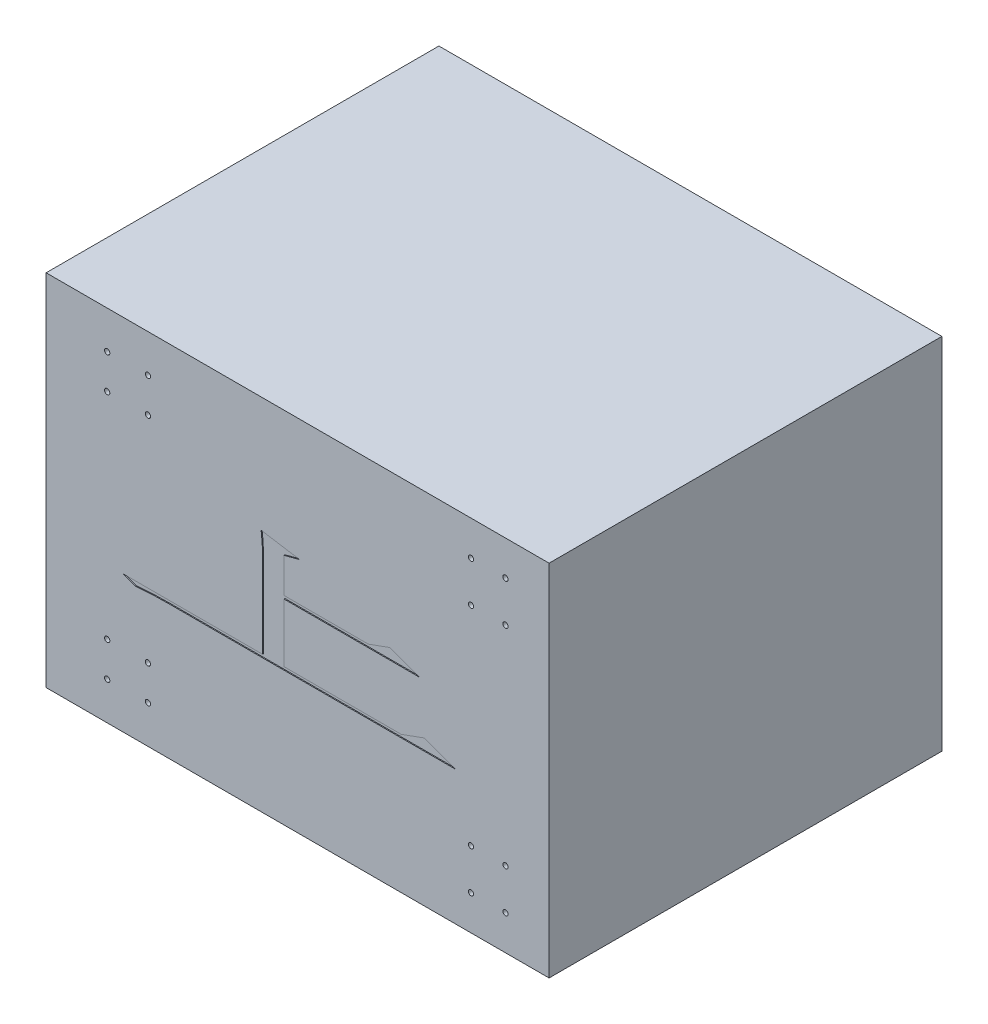
from build123d import *

# Parameters (mm, degrees)
SKETCH_1_W          = 1050
SKETCH_1_H          = 750
EXTRUDE_1_DEPTH     = 410
CUT_EXTRUDE_1_DEPTH = 2
SKETCH_3_W          = 44.350961538
SKETCH_3_H          = 70.432692308
SKETCH_3_W_2        = 43.26923077
SKETCH_3_H_2        = 67.868589743
CUT_EXTRUDE_2_DEPTH = 2
SKETCH_4_R          = 5.5
CUT_EXTRUDE_3_DEPTH = 1044.383918001


with BuildPart() as part:
    # 草图1 → 凸台-拉伸1 (new, symmetric)
    with BuildSketch(Plane.XY):
        Rectangle(SKETCH_1_W, SKETCH_1_H)
    extrude(amount=EXTRUDE_1_DEPTH, both=True)

    # 草图2 → 切除-拉伸1 (cut)
    with BuildSketch(Plane.XY.offset(410)):
        with BuildLine():
            Line((-76.251154182, 134.0391961), (4.317756074, 121.058426869))
            Line((4.317756074, 121.058426869), (-28.494743926, 112.404580715))
            Line((-28.494743926, 112.404580715), (-28.494743926, 39.928619177))
            Line((-28.494743926, 39.928619177), (147.586986844, 39.928619177))
            Line((147.586986844, 39.928619177), (192.37865351, 56.154580715))
            Line((192.37865351, 56.154580715), (255.038909921, 33.438234561))
            Line((255.038909921, 33.438234561), (-28.494743926, 33.438234561))
            Line((-28.494743926, 33.438234561), (-28.494743926, -88.797342362))
            Line((-28.494743926, -88.797342362), (216.256858639, -88.797342362))
            Line((216.256858639, -88.797342362), (264.013268895, -71.489650054))
            Line((264.013268895, -71.489650054), (329.678332998, -95.287726977))
            Line((329.678332998, -95.287726977), (-267.276795208, -95.287726977))
            add(Edge.make_bspline(
                [(-267.276795208, -95.287726977), (-273.620751945, -95.325303476), (-286.057863689, -95.398970927), (-304.346706585, -96.002609747), (-321.887243823, -97.027337306), (-333.317890865, -98.038240008), (-338.911410592, -98.532919285)],
                knots=[0, 0, 0, 0, 1.061212968, 2.080471985, 3.060690285, 4, 4, 4, 4], degree=3))
            Line((-338.911410592, -98.532919285), (-365.794423413, -88.797342362))
            Line((-365.794423413, -88.797342362), (-73.286410592, -88.797342362))
            Line((-73.286410592, -88.797342362), (-73.286410592, 92.933426869))
            add(Edge.make_bspline(
                [(-73.286410592, 92.933426869), (-73.334413425, 96.219120438), (-73.432034784, 102.901098434), (-73.934357846, 113.048263628), (-74.931633227, 123.464923567), (-75.806462429, 130.475560543), (-76.251154182, 134.0391961)],
                knots=[0, 0, 0, 0, 0.956090698, 1.944361784, 2.955081334, 4, 4, 4, 4], degree=3))
        make_face()
    extrude(amount=-CUT_EXTRUDE_1_DEPTH, mode=Mode.SUBTRACT)

    # 草图3 → 切除-拉伸2 (cut)
    # profile 1 of 9: a face of its own
    with BuildSketch(Plane.XZ.offset(375)):
        with BuildLine():
            add(Edge.make_bspline(
                [(-404.807692308, -86.738782051), (-404.799892776, -82.585443449), (-404.784644648, -74.465643327), (-404.893478511, -62.553437865), (-404.956781076, -51.175021558), (-405.074267337, -40.317449312), (-405.2527825, -29.994763235), (-405.379962594, -20.204495563), (-405.646456987, -10.950753367), (-405.810011732, -4.95460264), (-405.889423077, -2.043269231)],
                knots=[0, 0, 0, 0, 1.176774056, 2.30059984, 3.375236878, 4.400720187, 5.377068076, 6.300448943, 7.174810641, 8, 8, 8, 8], degree=3))
            Line((-405.889423077, -2.043269231), (-381.009615385, -14.0625))
            Line((-381.009615385, -14.0625), (-389.663461538, -20.592948718))
            Line((-389.663461538, -20.592948718), (-389.663461538, -84.575320513))
            Line((-389.663461538, -84.575320513), (-361.538461538, -79.166666667))
            add(Edge.make_bspline(
                [(-361.538461538, -79.166666667), (-361.530626213, -74.038439864), (-361.515343137, -64.03565347), (-361.623743276, -49.412405531), (-361.687656594, -35.523348588), (-361.803708403, -22.382137135), (-361.983807767, -9.962699167), (-362.109430245, 1.710405446), (-362.375166072, 12.647036331), (-362.540502834, 19.684828421), (-362.620192308, 23.076923077)],
                knots=[0, 0, 0, 0, 1.203660348, 2.34778176, 3.432348005, 4.463651956, 5.432303542, 6.347672805, 7.203606731, 8, 8, 8, 8], degree=3))
            Line((-362.620192308, 23.076923077), (-336.658653846, 9.975961538))
            Line((-336.658653846, 9.975961538), (-346.394230769, 3.405448718))
            Line((-346.394230769, 3.405448718), (-346.394230769, -29.407051282))
            Line((-346.394230769, -29.407051282), (-321.514423077, -29.407051282))
            Line((-321.514423077, -29.407051282), (-310.697115385, -18.58974359))
            Line((-310.697115385, -18.58974359), (-293.389423077, -35.897435897))
            Line((-293.389423077, -35.897435897), (-346.394230769, -35.897435897))
            Line((-346.394230769, -35.897435897), (-346.394230769, -75.921474359))
            Line((-346.394230769, -75.921474359), (-302.043269231, -66.185897436))
            Line((-302.043269231, -66.185897436), (-300.961538462, -70.512820513))
            add(Edge.make_bspline(
                [(-300.961538462, -70.512820513), (-303.913224017, -71.393238188), (-309.670724769, -73.110563876), (-318.09547259, -75.641532795), (-326.09602916, -78.041682138), (-333.68831737, -80.316402959), (-340.833021014, -82.537210656), (-347.572918266, -84.563949818), (-353.871396199, -86.503120997), (-359.771278173, -88.285674602), (-365.230857129, -90.032604873), (-370.298283331, -91.560327163), (-374.897878723, -93.082717017), (-379.111332731, -94.368746235), (-382.881242788, -95.627226399), (-386.227138186, -96.753911782), (-389.17953348, -97.699566896), (-392.460999823, -98.860464821), (-396.108079102, -100.17077468), (-400.108040107, -101.735718671), (-403.678137187, -103.296149598), (-406.879622699, -104.763047698), (-409.642236554, -106.247151167), (-412.013230252, -107.684806411), (-414.004997158, -109.06608487), (-415.112961549, -110.071987633), (-415.625, -110.536858974)],
                knots=[0, 0, 0, 0, 1.819420771, 3.548926964, 5.196075719, 6.753312958, 8.230490485, 9.61546289, 10.910532563, 12.123246011, 13.255940651, 14.296403935, 15.249368492, 16.117595642, 16.898389039, 17.596858801, 18.203035905, 18.729435959, 19.652750896, 20.49211647, 21.265864729, 21.954012815, 22.571630631, 23.116844881, 23.591855674, 24, 24, 24, 24], degree=3))
            Line((-415.625, -110.536858974), (-427.524038462, -89.983974359))
            add(Edge.make_bspline(
                [(-427.524038462, -89.983974359), (-423.643933233, -89.580429987), (-416.030259821, -88.788581604), (-408.500239139, -87.413224939), (-404.807692308, -86.738782051)],
                knots=[0, 0, 0, 0, 1.019246563, 2, 2, 2, 2], degree=3))
        make_face()
    # profile 2 of 9: a face of its own
    with BuildSketch(Plane.XZ.offset(375)):
        with BuildLine():
            add(Edge.make_bspline(
                [(-289.0625, -21.594551282), (-289.080879678, -18.068810816), (-289.118268257, -10.896627378), (-289.333549146, 0.067906138), (-289.635024506, 11.434492122), (-289.972524481, 19.15105108), (-290.144230769, 23.076923077)],
                knots=[0, 0, 0, 0, 0.946763555, 1.925939232, 2.944802063, 4, 4, 4, 4], degree=3))
            Line((-290.144230769, 23.076923077), (-263.100961538, 10.016025641))
            Line((-263.100961538, 10.016025641), (-273.918269231, 2.363782051))
            Line((-273.918269231, 2.363782051), (-273.918269231, -39.0625))
            add(Edge.make_bspline(
                [(-273.918269231, -39.0625), (-272.013162044, -38.063345575), (-267.981992376, -35.949154288), (-261.777217288, -32.260865348), (-255.0185978, -28.012280298), (-247.737643732, -23.21777054), (-240.205994484, -17.695950547), (-232.627175461, -11.37534592), (-225.03493263, -4.320830824), (-220.164590756, 0.813752719), (-217.668269231, 3.445512821)],
                knots=[0, 0, 0, 0, 0.728372157, 1.541221286, 2.443401956, 3.431780346, 4.492780516, 5.603946501, 6.771889103, 8, 8, 8, 8], degree=3))
            Line((-217.668269231, 3.445512821), (-200.360576923, -16.145833333))
            Line((-200.360576923, -16.145833333), (-213.341346154, -17.267628205))
            add(Edge.make_bspline(
                [(-213.341346154, -17.267628205), (-216.410350063, -18.848511822), (-222.388915106, -21.928148019), (-231.14471659, -26.33290881), (-239.42973809, -30.370066627), (-247.234379963, -34.087803439), (-254.580681975, -37.422759778), (-261.429410925, -40.491045376), (-267.815447513, -43.187176684), (-271.938717472, -44.812596533), (-273.918269231, -45.592948718)],
                knots=[0, 0, 0, 0, 1.238433146, 2.412526454, 3.515967226, 4.544591564, 5.513609216, 6.410099942, 7.236700607, 8, 8, 8, 8], degree=3))
            Line((-273.918269231, -45.592948718), (-273.918269231, -73.958333333))
            add(Edge.make_bspline(
                [(-273.918269231, -73.958333333), (-273.895201564, -74.976265029), (-273.851447296, -76.907056568), (-273.326251299, -79.59239488), (-272.520423572, -81.908334717), (-271.265039657, -83.749186577), (-269.753575448, -85.276994365), (-267.817568963, -86.315028208), (-265.554266487, -86.919785124), (-263.946326914, -86.984963564), (-263.100961538, -87.019230769)],
                knots=[0, 0, 0, 0, 1.258486359, 2.387070591, 3.376064703, 4.270393409, 5.124049302, 6.012241891, 6.95494712, 8, 8, 8, 8], degree=3))
            Line((-263.100961538, -87.019230769), (-221.995192308, -87.019230769))
            add(Edge.make_bspline(
                [(-221.995192308, -87.019230769), (-221.137604323, -86.982793758), (-219.492621999, -86.912902109), (-217.152824389, -86.325829008), (-215.151814041, -85.227847521), (-213.363697451, -83.82469459), (-211.978956102, -81.916699801), (-210.819943338, -79.670371157), (-210.061967332, -76.983771686), (-209.345860784, -72.874787336), (-208.831686479, -67.328031734), (-208.277365862, -60.438316938), (-208.021842004, -53.260333725), (-207.962834843, -48.397523353), (-207.932692308, -45.913461538)],
                knots=[0, 0, 0, 0, 0.640115454, 1.227837405, 1.780959176, 2.333811241, 2.910173113, 3.525580197, 4.213246791, 4.983825321, 6.63887077, 8.368789989, 10.145074671, 12, 12, 12, 12], degree=3))
            Line((-207.932692308, -45.913461538), (-203.605769231, -45.913461538))
            add(Edge.make_bspline(
                [(-203.605769231, -45.913461538), (-203.428531124, -48.318030256), (-203.092462158, -52.877438706), (-202.465805343, -59.345345367), (-201.712486274, -65.056056581), (-201.152928561, -69.393781069), (-200.418943037, -72.524082236), (-199.560380496, -74.663383009), (-198.443323087, -76.680989806), (-196.987079728, -78.557554123), (-195.289441245, -80.338596859), (-193.288790119, -82.006766032), (-190.99875101, -83.526090173), (-189.324789516, -84.403364544), (-188.461538462, -84.855769231)],
                knots=[0, 0, 0, 0, 1.952993343, 3.703156532, 5.26223588, 6.619235047, 7.243646851, 7.860327455, 8.48022538, 9.105479909, 9.7787641, 10.469886722, 11.210930534, 12, 12, 12, 12], degree=3))
            add(Edge.make_bspline(
                [(-188.461538462, -84.855769231), (-189.352186864, -86.368267844), (-191.027576677, -89.213413879), (-194.085124487, -92.814127198), (-197.33241993, -95.569218048), (-200.836913161, -97.406363851), (-204.434430413, -98.517240431), (-208.048004022, -99.371831049), (-211.748879078, -99.919207338), (-214.247615162, -99.972956906), (-215.504807692, -100)],
                knots=[0, 0, 0, 0, 1.27993623, 2.407675258, 3.43295007, 4.371008769, 5.274719207, 6.176110814, 7.08234412, 8, 8, 8, 8], degree=3))
            Line((-215.504807692, -100), (-269.591346154, -100))
            add(Edge.make_bspline(
                [(-269.591346154, -100), (-271.119047838, -99.957345009), (-274.003245979, -99.876815252), (-278.017626281, -98.99096874), (-281.46211219, -97.563797232), (-284.242961692, -95.451077684), (-286.511672758, -92.823715945), (-288.01700843, -89.519889227), (-288.885876803, -85.675076793), (-289.001415311, -82.937649892), (-289.0625, -81.490384615)],
                knots=[0, 0, 0, 0, 1.189363692, 2.245438743, 3.18754953, 4.072688701, 4.944682885, 5.866959989, 6.872271351, 8, 8, 8, 8], degree=3))
            Line((-289.0625, -81.490384615), (-289.0625, -21.594551282))
        make_face()
    # profile 3 of 9: a face of its own
    with BuildSketch(Plane.XZ.offset(375)):
        with BuildLine():
            add(Edge.make_bspline(
                [(-303.125, -138.461538462), (-303.123875317, -141.26602269), (-303.121690219, -146.714734905), (-303.137077022, -154.660857997), (-303.083385747, -162.166132418), (-303.046643286, -169.230775697), (-303.007113735, -175.854721228), (-302.962555851, -182.024541561), (-302.938632894, -187.754039848), (-302.845496639, -193.042230298), (-302.768979719, -197.876672874), (-302.688990819, -202.270404519), (-302.605564182, -206.209928421), (-302.541131463, -209.723151019), (-302.412263668, -212.780839505), (-302.294053299, -215.39846124), (-302.179035046, -217.562418797), (-302.084982997, -218.856944463), (-302.043269231, -219.431089744)],
                knots=[0, 0, 0, 0, 1.662194663, 3.229406773, 4.709572707, 6.110587711, 7.416621788, 8.635590239, 9.767493327, 10.812421321, 11.770292876, 12.633196279, 13.416962222, 14.10576766, 14.715701438, 15.230737947, 15.658818524, 16, 16, 16, 16], degree=3))
            Line((-302.043269231, -219.431089744), (-319.350961538, -228.205128205))
            add(Edge.make_bspline(
                [(-319.350961538, -228.205128205), (-319.177502556, -221.634890995), (-318.821098172, -208.135092286), (-318.529750279, -187.340419387), (-318.319535912, -165.451820371), (-318.286276116, -150.494181539), (-318.269230769, -142.828525641)],
                knots=[0, 0, 0, 0, 0.92368316, 1.897882272, 2.922683497, 4, 4, 4, 4], degree=3))
            add(Edge.make_bspline(
                [(-318.269230769, -142.828525641), (-320.229530413, -145.086665484), (-324.128442846, -149.577963301), (-330.246451655, -156.036186214), (-336.53689151, -162.253038569), (-343.032042698, -168.225795219), (-349.726630804, -173.958902293), (-356.622370273, -179.450719107), (-363.702551033, -184.692156753), (-370.980463707, -189.685214891), (-378.46574338, -194.391522729), (-386.129518067, -198.890691221), (-393.97588767, -203.149302373), (-402.05658488, -207.097345148), (-410.283446157, -210.876201224), (-418.73401616, -214.364849624), (-427.366689003, -217.610289283), (-433.233452254, -219.569559162), (-436.177884615, -220.552884615)],
                knots=[0, 0, 0, 0, 1.002971515, 1.994847125, 2.983165634, 3.969156496, 4.954057883, 5.939112072, 6.925560766, 7.908412301, 8.898951696, 9.890827306, 10.889025509, 11.892737054, 12.907088703, 13.92535985, 14.958772097, 16, 16, 16, 16], degree=3))
            Line((-436.177884615, -220.552884615), (-437.259615385, -216.185897436))
            add(Edge.make_bspline(
                [(-437.259615385, -216.185897436), (-431.889093174, -213.597507198), (-421.336404608, -208.511507181), (-406.249257866, -200.049320339), (-392.060440041, -191.144719118), (-378.890014566, -181.625187562), (-366.590952715, -171.682175698), (-355.288439465, -161.168581101), (-344.883708659, -150.159872184), (-338.662153898, -142.33957556), (-335.576923077, -138.461538462)],
                knots=[0, 0, 0, 0, 1.106797206, 2.174776634, 3.210193074, 4.215695543, 5.190514629, 6.145059252, 7.080146268, 8, 8, 8, 8], degree=3))
            Line((-335.576923077, -138.461538462), (-414.543269231, -138.461538462))
            Line((-414.543269231, -138.461538462), (-424.278846154, -140.625))
            Line((-424.278846154, -140.625), (-432.932692308, -131.971153846))
            Line((-432.932692308, -131.971153846), (-318.269230769, -131.971153846))
            add(Edge.make_bspline(
                [(-318.269230769, -131.971153846), (-318.288090432, -129.353508666), (-318.327065359, -123.94394568), (-318.543486171, -115.556843014), (-318.846805886, -106.633908506), (-319.179730648, -100.506986609), (-319.350961538, -97.355769231)],
                knots=[0, 0, 0, 0, 0.90691056, 1.874199695, 2.906651827, 4, 4, 4, 4], degree=3))
            Line((-319.350961538, -97.355769231), (-292.307692308, -110.336538462))
            Line((-292.307692308, -110.336538462), (-303.125, -116.826923077))
            Line((-303.125, -116.826923077), (-303.125, -131.971153846))
            Line((-303.125, -131.971153846), (-221.995192308, -131.971153846))
            Line((-221.995192308, -131.971153846), (-205.769230769, -115.745192308))
            Line((-205.769230769, -115.745192308), (-183.052884615, -138.461538462))
            Line((-183.052884615, -138.461538462), (-294.471153846, -138.461538462))
            add(Edge.make_bspline(
                [(-294.471153846, -138.461538462), (-292.704896767, -140.486333099), (-289.193796037, -144.511374534), (-283.53680006, -150.141630883), (-277.743759715, -155.524475662), (-271.72523596, -160.577102305), (-265.490953639, -165.317336316), (-259.062173019, -169.766979249), (-252.391806735, -173.854905171), (-245.523251162, -177.61856537), (-238.464648712, -181.121422145), (-231.181479496, -184.289609522), (-223.663346231, -187.07499936), (-215.961414939, -189.620199117), (-208.030627503, -191.817158535), (-199.884085257, -193.680224288), (-191.555157095, -195.325297509), (-185.902122426, -196.089291408), (-183.052884615, -196.474358974)],
                knots=[0, 0, 0, 0, 1.00227071, 1.992390272, 2.976220261, 3.952385687, 4.923105148, 5.897564813, 6.868424952, 7.840780129, 8.819092609, 9.807756554, 10.802729427, 11.809659271, 12.833656939, 13.871970379, 14.927432289, 16, 16, 16, 16], degree=3))
            Line((-183.052884615, -196.474358974), (-183.052884615, -200.841346154))
            add(Edge.make_bspline(
                [(-183.052884615, -200.841346154), (-184.35339265, -201.056460252), (-186.847167761, -201.468949963), (-190.375918559, -202.469663005), (-193.517644788, -203.800121492), (-196.322335847, -205.387780759), (-198.724464103, -207.345151985), (-200.750318148, -209.616980507), (-202.418594063, -212.200391527), (-203.206848615, -214.101823871), (-203.605769231, -215.064102564)],
                knots=[0, 0, 0, 0, 1.198293132, 2.29777403, 3.326477309, 4.295206544, 5.219035116, 6.130888892, 7.054078469, 8, 8, 8, 8], degree=3))
            add(Edge.make_bspline(
                [(-203.605769231, -215.064102564), (-206.15205199, -214.138931571), (-211.207176322, -212.302193533), (-218.593046202, -209.155603408), (-225.750926661, -205.73649), (-232.748599604, -202.142894035), (-239.519239497, -198.262081486), (-246.051810818, -194.077421571), (-252.388138139, -189.668924746), (-258.534705403, -185.01850654), (-264.454977253, -180.096666549), (-270.151349795, -174.911541717), (-275.654885152, -169.495321735), (-280.951311242, -163.814162524), (-285.974444481, -157.829969785), (-290.850370385, -151.649038336), (-295.510137523, -145.197483661), (-298.416172339, -140.717765397), (-299.879807692, -138.461538462)],
                knots=[0, 0, 0, 0, 1.036595478, 2.057948595, 3.070647218, 4.071803187, 5.067649195, 6.055793975, 7.03968734, 8.020935843, 9.004417662, 9.98486732, 10.967831143, 11.958655097, 12.955903272, 13.956811373, 14.970940371, 16, 16, 16, 16], degree=3))
            Line((-299.879807692, -138.461538462), (-303.125, -138.461538462))
        make_face()
    # profile 4 of 9: a face of its own
    with BuildSketch(Plane.XZ.offset(375)):
        with BuildLine():
            add(Edge.make_bspline(
                [(-62.980769231, -220.512820513), (-62.809549569, -217.014332391), (-62.4763449, -210.206045536), (-62.17161305, -200.255019167), (-61.95650096, -190.839595047), (-61.917824698, -184.735687078), (-61.899038462, -181.770833333)],
                knots=[0, 0, 0, 0, 1.084377967, 2.110270495, 3.082100905, 4, 4, 4, 4], degree=3))
            Line((-61.899038462, -181.770833333), (-61.899038462, -68.709935897))
            add(Edge.make_bspline(
                [(-61.899038462, -68.709935897), (-61.951936505, -62.525553755), (-62.059487887, -49.951575395), (-62.670352238, -37.391928779), (-62.980769231, -31.009615385)],
                knots=[0, 0, 0, 0, 0.983679463, 2, 2, 2, 2], degree=3))
            Line((-62.980769231, -31.009615385), (-47.836538462, -39.663461538))
            Line((-47.836538462, -39.663461538), (-4.567307692, -39.663461538))
            add(Edge.make_bspline(
                [(-4.567307692, -39.663461538), (-4.568425052, -37.406520717), (-4.570606879, -32.999476511), (-4.555157505, -26.57577108), (-4.608727542, -20.512819366), (-4.645759259, -14.823710443), (-4.68540971, -9.48181432), (-4.729441844, -4.500569514), (-4.754106098, 0.133912342), (-4.846162674, 4.393745599), (-4.923716163, 8.293348848), (-5.003372697, 11.832393023), (-5.086467366, 15.010684439), (-5.151481799, 17.84301658), (-5.279126433, 20.299688449), (-5.400125955, 22.409669879), (-5.510960893, 24.146710566), (-5.607096394, 25.187116552), (-5.649038462, 25.641025641)],
                knots=[0, 0, 0, 0, 1.658358736, 3.238215284, 4.719976587, 6.113424988, 7.418560765, 8.645196714, 9.77370834, 10.823858514, 11.775899855, 12.63964692, 13.424914088, 14.112088547, 14.72119231, 15.232305013, 15.665069467, 16, 16, 16, 16], degree=3))
            Line((-5.649038462, 25.641025641), (19.230769231, 14.943910256))
            Line((19.230769231, 14.943910256), (9.495192308, 7.451923077))
            Line((9.495192308, 7.451923077), (9.495192308, -39.663461538))
            Line((9.495192308, -39.663461538), (52.764423077, -39.663461538))
            Line((52.764423077, -39.663461538), (60.336538462, -28.846153846))
            Line((60.336538462, -28.846153846), (76.5625, -42.908653846))
            Line((76.5625, -42.908653846), (67.908653846, -49.358974359))
            Line((67.908653846, -49.358974359), (67.908653846, -182.852564103))
            add(Edge.make_bspline(
                [(67.908653846, -182.852564103), (67.958843528, -187.875485571), (68.059285135, -197.927557792), (68.679889925, -207.960959513), (68.990384615, -212.980769231)],
                knots=[0, 0, 0, 0, 0.999380299, 2, 2, 2, 2], degree=3))
            Line((68.990384615, -212.980769231), (53.846153846, -220.512820513))
            Line((53.846153846, -220.512820513), (53.846153846, -197.435897436))
            Line((53.846153846, -197.435897436), (-47.836538462, -197.435897436))
            Line((-47.836538462, -197.435897436), (-47.836538462, -213.90224359))
            Line((-47.836538462, -213.90224359), (-62.980769231, -220.512820513))
        make_face()
        with Locations((31.670673077, -155.729166667)):
            Rectangle(SKETCH_3_W, SKETCH_3_H, mode=Mode.SUBTRACT)
        with Locations((-26.201923077, -80.088141026)):
            Rectangle(SKETCH_3_W_2, SKETCH_3_H_2, mode=Mode.SUBTRACT)
        with Locations((31.670673077, -80.088141026)):
            Rectangle(SKETCH_3_W, SKETCH_3_H_2, mode=Mode.SUBTRACT)
        with Locations((-26.201923077, -155.729166667)):
            Rectangle(SKETCH_3_W_2, SKETCH_3_H, mode=Mode.SUBTRACT)
    # profile 5 of 9: a face of its own
    with BuildSketch(Plane.XZ.offset(375)):
        with BuildLine():
            add(Edge.make_bspline(
                [(-68.389423077, -29.52724359), (-69.927313847, -34.133917263), (-72.917510885, -43.090900584), (-77.235744749, -56.141341095), (-81.286357233, -68.399599681), (-85.049147177, -79.876753482), (-88.57537333, -90.555916915), (-91.832838169, -100.461131989), (-94.776185529, -109.593718599), (-97.52116709, -117.929345415), (-99.956534394, -125.490941785), (-102.11942461, -132.261951698), (-104.018186842, -138.240042715), (-105.599784321, -143.445690614), (-106.98212117, -147.855793464), (-108.063720326, -151.488807188), (-108.864541351, -154.350628547), (-109.955851049, -158.304351362), (-110.989848727, -163.96286493), (-112.057390448, -171.767227931), (-112.621867458, -180.333341144), (-112.755563047, -187.819800241), (-112.737819343, -193.856836792), (-112.740954201, -198.063567363), (-112.740335554, -201.842952759), (-112.740158899, -205.208320726), (-112.741168003, -208.146406573), (-112.738075855, -210.683646442), (-112.746917375, -212.794126503), (-112.717304924, -214.921156609), (-112.86684746, -217.01911595), (-113.633622399, -219.047123799), (-115.165839936, -220.359184961), (-116.416212374, -220.460213053), (-117.067307692, -220.512820513)],
                knots=[0, 0, 0, 0, 2.330176268, 4.530676893, 6.595424638, 8.524422367, 10.325760191, 11.991349383, 13.527287595, 14.929469261, 16.202006203, 17.338815461, 18.339909382, 19.211428259, 19.949157814, 20.557367496, 21.030007305, 21.375063583, 22.524872345, 23.785398983, 25.153583848, 26.640476982, 27.377343417, 28.050134511, 28.658850262, 29.190675603, 29.664833135, 30.068507791, 30.408107105, 30.677223542, 31.089751325, 31.411151606, 31.693374213, 32, 32, 32, 32], degree=3))
            add(Edge.make_bspline(
                [(-117.067307692, -220.512820513), (-117.683859699, -220.475508926), (-119.107131193, -220.389377477), (-121.446013379, -219.810136065), (-124.258947988, -218.94418399), (-127.402896473, -217.906831259), (-130.512116014, -216.338910392), (-132.798129675, -213.709891972), (-134.182126133, -210.366535381), (-134.307753797, -207.894010448), (-134.375, -206.570512821)],
                knots=[0, 0, 0, 0, 0.595270163, 1.374143697, 2.31631919, 3.437627346, 4.574611688, 5.6248949, 6.728649437, 8, 8, 8, 8], degree=3))
            add(Edge.make_bspline(
                [(-134.375, -206.570512821), (-134.272341535, -204.047730741), (-134.06554906, -198.965905752), (-132.832474818, -194.031354813), (-132.211538462, -191.546474359)],
                knots=[0, 0, 0, 0, 0.992864605, 2, 2, 2, 2], degree=3))
            add(Edge.make_bspline(
                [(-132.211538462, -191.546474359), (-131.729783343, -189.854208883), (-130.820423429, -186.659892254), (-129.753885988, -182.09687749), (-129.111365736, -178.04981414), (-129.012068858, -175.522646013), (-128.966346154, -174.358974359)],
                knots=[0, 0, 0, 0, 1.203293849, 2.271334849, 3.204010761, 4, 4, 4, 4], degree=3))
            add(Edge.make_bspline(
                [(-128.966346154, -174.358974359), (-129.032114816, -173.325309463), (-129.160220979, -171.311906113), (-130.048421215, -168.400032849), (-131.695396556, -165.85431255), (-133.469451682, -163.903928758), (-135.312921158, -162.506930629), (-137.062531071, -161.409095176), (-139.182573486, -160.358799259), (-141.640343207, -159.272019239), (-144.442861448, -158.186161268), (-147.628349244, -157.173004102), (-151.145518453, -156.073989327), (-153.629976865, -155.400115727), (-154.927884615, -155.048076923)],
                knots=[0, 0, 0, 0, 1.061906119, 2.068412448, 3.084778515, 4.152427813, 4.758781837, 5.455256692, 6.271167899, 7.186216139, 8.215368344, 9.356203438, 10.618852289, 12, 12, 12, 12], degree=3))
            Line((-154.927884615, -155.048076923), (-154.927884615, -150.761217949))
            add(Edge.make_bspline(
                [(-154.927884615, -150.761217949), (-153.538680132, -150.91858076), (-150.893612878, -151.218202037), (-147.107344644, -151.692757185), (-143.6716228, -151.997487761), (-140.58688363, -152.245178699), (-137.86214393, -152.407206384), (-135.483904406, -152.496877331), (-133.466767348, -152.492083704), (-131.210946578, -152.440200135), (-128.506128257, -151.695368284), (-125.455007544, -149.692224572), (-122.518641659, -146.610215506), (-120.309480622, -143.692223061), (-118.773191888, -141.009086172), (-117.609300711, -138.737727256), (-116.18735603, -135.714687953), (-114.515957727, -131.91800695), (-112.503120851, -127.41994308), (-110.268805867, -122.148091428), (-107.742712326, -116.139330737), (-104.93940477, -109.367878073), (-101.86803356, -101.8436335), (-98.480615672, -93.591327771), (-94.902099625, -84.55516513), (-90.949063794, -74.800887304), (-86.809653959, -64.261179359), (-82.347595326, -52.995737178), (-77.623034241, -40.975295915), (-74.384769184, -32.706019768), (-72.716346154, -28.445512821)],
                knots=[0, 0, 0, 0, 0.721490397, 1.373729098, 1.968972639, 2.501240816, 2.97068533, 3.377528162, 3.729003983, 4.011898956, 4.540181391, 5.15016345, 5.87139048, 6.728733543, 7.03134042, 7.46595378, 8.045511111, 8.755053279, 9.606643322, 10.588484413, 11.709712696, 12.970363299, 14.370460851, 15.903639561, 17.573717696, 19.385850263, 21.334929756, 23.417107745, 25.638796438, 28, 28, 28, 28], degree=3))
            Line((-72.716346154, -28.445512821), (-68.389423077, -29.52724359))
        make_face()
    # profile 6 of 9: a face of its own
    with BuildSketch(Plane.XZ.offset(375)):
        with BuildLine():
            add(Edge.make_bspline(
                [(-153.846153846, -48.317307692), (-151.043389801, -49.57473843), (-145.749940501, -51.949589024), (-138.464380837, -55.668235506), (-132.248578743, -59.21627175), (-127.138253755, -62.630926374), (-123.107697133, -65.909799495), (-120.148042997, -69.015884204), (-118.194678303, -72.040354115), (-117.386312344, -75.81790412), (-117.563793838, -79.88053575), (-117.983099259, -84.064159933), (-118.97216172, -87.443657006), (-120.713725597, -89.780877469), (-122.500242275, -91.373438656), (-124.096695411, -92.490234658), (-125.481190692, -93.281002755), (-126.395268767, -93.41140214), (-126.802884615, -93.469551282)],
                knots=[0, 0, 0, 0, 2.137318138, 4.036652752, 5.689570708, 7.114910685, 8.309515839, 9.295970364, 10.096028149, 10.774477224, 11.945389058, 12.910156725, 13.703602796, 14.356097679, 14.908696276, 15.362435972, 15.715690367, 16, 16, 16, 16], degree=3))
            add(Edge.make_bspline(
                [(-126.802884615, -93.469551282), (-127.364164293, -93.313568552), (-128.715616883, -92.937992395), (-130.315741098, -90.853488884), (-131.863321555, -87.85644623), (-132.77494382, -85.407074196), (-133.293269231, -84.014423077)],
                knots=[0, 0, 0, 0, 0.573729661, 1.381429734, 2.511147037, 4, 4, 4, 4], degree=3))
            add(Edge.make_bspline(
                [(-133.293269231, -84.014423077), (-133.698466686, -82.909695697), (-134.556571714, -80.570164424), (-136.390486799, -77.064955679), (-138.539195725, -73.230072032), (-141.203286954, -69.178437504), (-144.261553412, -64.835365073), (-147.741949518, -60.221731691), (-151.729140241, -55.395691685), (-154.548660647, -52.105485156), (-156.009615385, -50.400641026)],
                knots=[0, 0, 0, 0, 0.691799597, 1.465055381, 2.323882694, 3.278718458, 4.31662617, 5.449951299, 6.678673961, 8, 8, 8, 8], degree=3))
            Line((-156.009615385, -50.400641026), (-153.846153846, -48.317307692))
        make_face()
    # profile 7 of 9: a face of its own
    with BuildSketch(Plane.XZ.offset(375)):
        with BuildLine():
            add(Edge.make_bspline(
                [(-128.966346154, 10.496794872), (-126.663985549, 9.480108685), (-122.306771813, 7.556031713), (-116.227807096, 4.659148902), (-110.924665332, 2.050626099), (-106.474415474, -0.40520853), (-102.79617894, -2.582943309), (-99.935823274, -4.578984807), (-97.826567676, -6.326106005), (-96.230458872, -8.403110519), (-95.1871361, -10.758597864), (-94.065363435, -13.147809807), (-93.426431317, -15.271949658), (-93.31769183, -16.596982965), (-93.269230769, -17.1875)],
                knots=[0, 0, 0, 0, 1.910941389, 3.6164535, 5.11297384, 6.397322516, 7.475544486, 8.356123146, 9.045817229, 9.544760398, 10.329312956, 10.992403041, 11.550952293, 12, 12, 12, 12], degree=3))
            add(Edge.make_bspline(
                [(-93.269230769, -17.1875), (-93.313244068, -17.938354045), (-93.406433028, -19.52813054), (-94.040537575, -21.988973807), (-95.13754101, -24.602936265), (-96.447336953, -27.291919446), (-97.901688461, -29.7276859), (-99.31539646, -31.548802585), (-100.552362428, -32.867512941), (-101.519966011, -33.083214172), (-101.923076923, -33.173076923)],
                knots=[0, 0, 0, 0, 0.950821945, 2.013166728, 3.197105655, 4.535802205, 5.803276501, 6.767391034, 7.486485857, 8, 8, 8, 8], degree=3))
            add(Edge.make_bspline(
                [(-101.923076923, -33.173076923), (-102.482032344, -33.044720186), (-103.8022186, -32.741556831), (-105.41934131, -30.847997041), (-106.975015723, -28.124345474), (-107.893745864, -25.89853814), (-108.413461538, -24.639423077)],
                knots=[0, 0, 0, 0, 0.602985712, 1.424180568, 2.542886889, 4, 4, 4, 4], degree=3))
            add(Edge.make_bspline(
                [(-108.413461538, -24.639423077), (-108.987153235, -23.456916053), (-110.171985223, -21.01471207), (-112.288511833, -17.366980963), (-114.68583477, -13.575071402), (-117.378535124, -9.651131595), (-120.353247955, -5.575102275), (-123.680139528, -1.400620918), (-127.281053915, 2.932551454), (-129.82677561, 5.815846881), (-131.129807692, 7.291666667)],
                knots=[0, 0, 0, 0, 0.802080547, 1.656518116, 2.572519223, 3.54031123, 4.561043358, 5.652173592, 6.798260965, 8, 8, 8, 8], degree=3))
            Line((-131.129807692, 7.291666667), (-128.966346154, 10.496794872))
        make_face()
    # profile 8 of 9: a face of its own
    with BuildSketch(Plane.XZ.offset(375)):
        with BuildLine():
            Line((252.884615385, -7.692307692), (252.884615385, -101.72275641))
            add(Edge.make_bspline(
                [(252.884615385, -101.72275641), (252.841196881, -105.00951256), (252.755664416, -111.484271731), (251.995364298, -121.05604814), (250.866218244, -130.328536992), (249.221965485, -139.322846511), (247.051511147, -147.998270477), (244.448307507, -156.386851837), (241.403176734, -164.496027392), (237.826387667, -172.283747153), (233.833845865, -179.819775895), (229.271512789, -186.989530467), (224.295606816, -193.89237629), (218.888770346, -200.537755161), (212.929036615, -206.827927403), (206.504284524, -212.827125999), (199.664109052, -218.60029022), (194.776093449, -222.107232705), (192.307692308, -223.878205128)],
                knots=[0, 0, 0, 0, 1.108626279, 2.183943025, 3.237300058, 4.258815003, 5.266274601, 6.252363065, 7.220493292, 8.186198952, 9.141582016, 10.095274576, 11.05056203, 12.011041014, 12.983104791, 13.971187867, 14.975469272, 16, 16, 16, 16], degree=3))
            Line((192.307692308, -223.878205128), (189.0625, -220.633012821))
            add(Edge.make_bspline(
                [(189.0625, -220.633012821), (191.046217027, -218.770916302), (194.993539843, -215.065601495), (200.518880588, -209.165930014), (205.656301166, -203.017319127), (210.433419383, -196.648923934), (214.815694501, -190.030298105), (218.754751276, -183.149760457), (222.458169872, -176.107289916), (225.621056901, -168.755833253), (228.492171238, -161.196888855), (230.969639429, -153.399983415), (233.045770399, -145.357823197), (234.782724557, -137.099386732), (236.085192756, -128.590371868), (237.056494442, -119.850249829), (237.6169325, -110.864744435), (237.698896234, -104.795091626), (237.740384615, -101.72275641)],
                knots=[0, 0, 0, 0, 0.985314845, 1.960640411, 2.925594497, 3.886283397, 4.842871568, 5.798676654, 6.757109883, 7.723227236, 8.695332628, 9.685137536, 10.684763635, 11.702725791, 12.740583817, 13.80148723, 14.887157401, 16, 16, 16, 16], degree=3))
            Line((237.740384615, -101.72275641), (237.740384615, -49.83974359))
            add(Edge.make_bspline(
                [(237.740384615, -49.83974359), (237.688631962, -40.023282656), (237.584124484, -20.200268733), (236.969109945, -0.386500964), (236.658653846, 9.615384615)],
                knots=[0, 0, 0, 0, 0.990410537, 2, 2, 2, 2], degree=3))
            Line((236.658653846, 9.615384615), (252.884615385, -1.201923077))
            Line((252.884615385, -1.201923077), (302.644230769, -1.201923077))
            Line((302.644230769, -1.201923077), (312.379807692, 9.615384615))
            Line((312.379807692, 9.615384615), (329.6875, -5.528846154))
            Line((329.6875, -5.528846154), (318.870192308, -12.059294872))
            Line((318.870192308, -12.059294872), (318.870192308, -188.982371795))
            add(Edge.make_bspline(
                [(318.870192308, -188.982371795), (318.892286555, -189.840572044), (318.933853232, -191.455134011), (319.464870538, -193.693712539), (320.301456403, -195.61482948), (321.541997416, -197.151144387), (323.068005336, -198.431373787), (325.008738042, -199.233255849), (327.240407853, -199.775724613), (328.842296121, -199.817632004), (329.6875, -199.83974359)],
                knots=[0, 0, 0, 0, 1.17022464, 2.201584301, 3.124385285, 4.007915669, 4.87719616, 5.81662875, 6.847988411, 8, 8, 8, 8], degree=3))
            Line((329.6875, -199.83974359), (342.668269231, -199.83974359))
            add(Edge.make_bspline(
                [(342.668269231, -199.83974359), (343.523051072, -199.725124497), (345.270798361, -199.490766208), (347.550747246, -197.646877827), (349.173922669, -194.760175245), (350.180979854, -191.664817911), (350.83113769, -188.475994076), (351.274591729, -185.287466502), (351.783085071, -181.43291913), (352.139682888, -176.897430032), (352.559961969, -171.691571833), (352.905740265, -165.813772286), (353.230543321, -159.256501221), (353.397663493, -154.661032369), (353.485576923, -152.243589744)],
                knots=[0, 0, 0, 0, 0.593285662, 1.213073742, 1.959102594, 2.885957232, 3.477257056, 4.23234027, 5.135388809, 6.194265944, 7.411285708, 8.785969923, 10.309262111, 12, 12, 12, 12], degree=3))
            Line((353.485576923, -152.243589744), (358.894230769, -152.243589744))
            add(Edge.make_bspline(
                [(358.894230769, -152.243589744), (358.906765161, -154.139914537), (358.930864031, -157.785826212), (358.978419809, -163.009610806), (359.19855371, -167.73665722), (359.43729081, -171.97036493), (359.697303629, -175.713677558), (360.053220405, -178.975380542), (360.482011662, -181.746564221), (361.143503854, -184.750355592), (362.375393484, -188.059900201), (364.802214423, -191.432899212), (367.94213104, -194.420289676), (370.526930793, -195.84927979), (371.875, -196.594551282)],
                knots=[0, 0, 0, 0, 1.392277126, 2.676819629, 3.834791772, 4.865946343, 5.79012363, 6.58917741, 7.274232445, 7.847440921, 8.84702178, 9.839799572, 10.873375133, 12, 12, 12, 12], degree=3))
            add(Edge.make_bspline(
                [(371.875, -196.594551282), (371.341432093, -197.630684786), (370.327423307, -199.599784621), (368.656931626, -202.300772284), (367.035109205, -204.683184206), (365.354745373, -206.708319986), (363.615856277, -208.351836949), (361.914589454, -209.705998391), (360.146055466, -210.659869259), (356.70488678, -211.761465489), (351.57023775, -212.527070546), (347.036578232, -212.724498161), (344.831730769, -212.820512821)],
                knots=[0, 0, 0, 0, 1.024250653, 1.9465173, 2.790090786, 3.556785589, 4.254377239, 4.890791374, 5.463349847, 6.009159617, 8.059140908, 10, 10, 10, 10], degree=3))
            Line((344.831730769, -212.820512821), (322.115384615, -212.820512821))
            add(Edge.make_bspline(
                [(322.115384615, -212.820512821), (320.669076674, -212.770546215), (317.951530362, -212.676661254), (314.144915645, -211.887237884), (310.913385975, -210.53199889), (308.243620627, -208.600025036), (306.183574717, -206.070561278), (304.749509587, -202.987227753), (303.849954654, -199.395752897), (303.768777536, -196.827404273), (303.725961538, -195.47275641)],
                knots=[0, 0, 0, 0, 1.197894128, 2.250788146, 3.20273384, 4.081608432, 4.954608877, 5.875416252, 6.87941115, 8, 8, 8, 8], degree=3))
            Line((303.725961538, -195.47275641), (303.725961538, -7.692307692))
            Line((303.725961538, -7.692307692), (252.884615385, -7.692307692))
        make_face()
    # profile 9 of 9: a face of its own
    with BuildSketch(Plane.XZ.offset(375)):
        with BuildLine():
            add(Edge.make_bspline(
                [(180.408653846, -83.092948718), (180.409767152, -87.727028159), (180.411936014, -96.754802517), (180.396595453, -109.93593792), (180.450216278, -122.409188154), (180.487159303, -134.174682897), (180.526666835, -145.245738075), (180.571110554, -155.608955985), (180.595106134, -165.264600528), (180.688379361, -174.212088084), (180.765654045, -182.465308689), (180.84393467, -190.010752712), (180.929240875, -196.848273029), (180.992455342, -202.978627584), (181.122681856, -208.400293991), (181.240917834, -213.114554643), (181.357549448, -217.12114954), (181.448932885, -219.564684179), (181.490384615, -220.673076923)],
                knots=[0, 0, 0, 0, 1.616663304, 3.14946511, 4.59841291, 5.968158618, 7.254043346, 8.460726103, 9.583548035, 10.622540587, 11.582334062, 12.462929081, 13.25500914, 13.967892764, 14.601667102, 15.146945995, 15.613052807, 16, 16, 16, 16], degree=3))
            Line((181.490384615, -220.673076923), (164.182692308, -228.205128205))
            add(Edge.make_bspline(
                [(164.182692308, -228.205128205), (164.262739936, -224.078531937), (164.430345044, -215.438193374), (164.694410824, -201.910541452), (164.820672125, -187.232847562), (164.99973737, -171.407857607), (165.115857429, -154.433883409), (165.179395153, -136.32477799), (165.287748017, -117.080767063), (165.272348552, -103.872879906), (165.264423077, -97.075320513)],
                knots=[0, 0, 0, 0, 0.755372881, 1.581612788, 2.476211096, 3.441684722, 4.478014026, 5.582763334, 6.755947139, 8, 8, 8, 8], degree=3))
            add(Edge.make_bspline(
                [(165.264423077, -97.075320513), (163.873276048, -100.803004425), (161.10842324, -108.211637097), (156.315603726, -118.997042388), (151.035822402, -129.430725937), (145.379715521, -139.590636864), (139.146853203, -149.354479223), (132.480192248, -158.796233602), (125.360108055, -167.921405692), (120.23654454, -173.7039588), (117.668269231, -176.602564103)],
                knots=[0, 0, 0, 0, 1.023436362, 2.034041579, 3.034309397, 4.031101673, 5.024263628, 6.012779382, 7.003871108, 8, 8, 8, 8], degree=3))
            Line((117.668269231, -176.602564103), (115.504807692, -173.397435897))
            add(Edge.make_bspline(
                [(115.504807692, -173.397435897), (118.169402501, -169.098051881), (123.572935296, -160.37932945), (130.910119677, -146.59813063), (137.758144595, -132.087292197), (144.086970194, -116.842800522), (149.881107754, -100.87091059), (155.216970787, -84.183511562), (160.035100481, -66.739152937), (162.784763816, -54.791920287), (164.182692308, -48.717948718)],
                knots=[0, 0, 0, 0, 0.902120954, 1.829411416, 2.783192599, 3.763614176, 4.772747686, 5.813216077, 6.88823933, 8, 8, 8, 8], degree=3))
            Line((164.182692308, -48.717948718), (138.221153846, -48.717948718))
            Line((138.221153846, -48.717948718), (128.485576923, -50.881410256))
            Line((128.485576923, -50.881410256), (119.831730769, -42.227564103))
            Line((119.831730769, -42.227564103), (165.264423077, -42.227564103))
            add(Edge.make_bspline(
                [(165.264423077, -42.227564103), (165.247151128, -36.017559919), (165.213237795, -23.824266692), (165.002625384, -5.87525858), (164.70938549, 11.393966449), (164.355900778, 22.676604744), (164.182692308, 28.205128205)],
                knots=[0, 0, 0, 0, 1.057861585, 2.077102707, 3.057775095, 4, 4, 4, 4], degree=3))
            Line((164.182692308, 28.205128205), (187.980769231, 18.469551282))
            Line((187.980769231, 18.469551282), (180.408653846, 10.857371795))
            Line((180.408653846, 10.857371795), (180.408653846, -42.227564103))
            Line((180.408653846, -42.227564103), (195.552884615, -42.227564103))
            Line((195.552884615, -42.227564103), (207.451923077, -30.328525641))
            Line((207.451923077, -30.328525641), (225.841346154, -48.717948718))
            Line((225.841346154, -48.717948718), (180.408653846, -48.717948718))
            Line((180.408653846, -48.717948718), (180.408653846, -77.724358974))
            add(Edge.make_bspline(
                [(180.408653846, -77.724358974), (182.47963635, -78.509630124), (186.440512386, -80.011507457), (192.099257563, -82.20492281), (197.199556652, -84.293553915), (201.741007553, -86.243063123), (205.731373821, -88.039844402), (209.150338301, -89.726804974), (212.018626944, -91.264620668), (215.026647649, -93.08385098), (218.052851287, -95.438353037), (220.686153861, -98.828378142), (222.301443327, -102.670968207), (222.49715927, -105.39367037), (222.596153846, -106.770833333)],
                knots=[0, 0, 0, 0, 1.472016443, 2.81531816, 4.033350152, 5.134678953, 6.099880211, 6.941381202, 7.668153446, 8.261825946, 9.277881501, 10.195682921, 11.087363029, 12, 12, 12, 12], degree=3))
            add(Edge.make_bspline(
                [(222.596153846, -106.770833333), (222.527036069, -108.570516209), (222.387171765, -112.212291198), (221.243525397, -116.531075246), (220.326336486, -119.690123834), (219.546031141, -121.309659935), (219.047343075, -122.514178968), (218.46908968, -122.783513707), (218.269230769, -122.876602564)],
                knots=[0, 0, 0, 0, 1.895571212, 3.835811256, 4.710206953, 5.341871525, 5.772534254, 6, 6, 6, 6], degree=3))
            add(Edge.make_bspline(
                [(218.269230769, -122.876602564), (217.969411328, -122.842240115), (217.303615619, -122.765932952), (216.338596945, -122.16659636), (215.293849434, -121.305986901), (214.125164021, -120.123382351), (212.860012767, -118.605298584), (211.507686897, -116.741905408), (210.008294424, -114.582985885), (209.04506657, -112.986862874), (208.533653846, -112.139423077)],
                knots=[0, 0, 0, 0, 0.48279052, 1.072111453, 1.793717756, 2.679214007, 3.751835041, 4.986873208, 6.400221324, 8, 8, 8, 8], degree=3))
            add(Edge.make_bspline(
                [(208.533653846, -112.139423077), (206.780817992, -109.616482354), (203.163985597, -104.410601998), (196.565467077, -97.111239986), (188.999622673, -89.856513827), (183.333993568, -85.396033047), (180.408653846, -83.092948718)],
                knots=[0, 0, 0, 0, 0.906748205, 1.871000228, 2.900731502, 4, 4, 4, 4], degree=3))
        make_face()
    extrude(amount=-CUT_EXTRUDE_2_DEPTH, mode=Mode.SUBTRACT)

    # 草图4 → 切除-拉伸3 (cut, through all)
    with BuildSketch(Plane(origin=(0, 0, -410), x_dir=(-1, 0, 0), z_dir=(0, 0, -1))):
        with Locations((-434, 302.5)):
            Circle(SKETCH_4_R)
        with Locations((-362, 302.5)):
            Circle(SKETCH_4_R)
        with Locations((-434, 217.5)):
            Circle(SKETCH_4_R)
        with Locations((-362, 217.5)):
            Circle(SKETCH_4_R)
        with Locations((312.5, 296)):
            Circle(SKETCH_4_R)
        with Locations((397.5, 296)):
            Circle(SKETCH_4_R)
        with Locations((312.5, 224)):
            Circle(SKETCH_4_R)
        with Locations((397.5, 224)):
            Circle(SKETCH_4_R)
        with Locations((-434, -217.5)):
            Circle(SKETCH_4_R)
        with Locations((-362, -217.5)):
            Circle(SKETCH_4_R)
        with Locations((-434, -302.5)):
            Circle(SKETCH_4_R)
        with Locations((-362, -302.5)):
            Circle(SKETCH_4_R)
        with Locations((312.5, -224)):
            Circle(SKETCH_4_R)
        with Locations((397.5, -224)):
            Circle(SKETCH_4_R)
        with Locations((312.5, -296)):
            Circle(SKETCH_4_R)
        with Locations((397.5, -296)):
            Circle(SKETCH_4_R)
    extrude(amount=-CUT_EXTRUDE_3_DEPTH, mode=Mode.SUBTRACT)


solid = part.part
